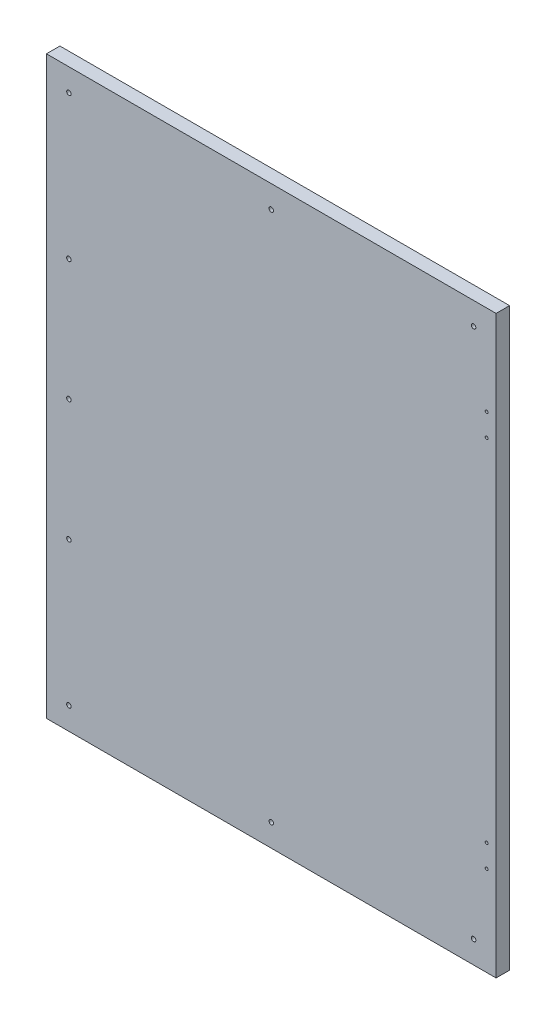
from build123d import *

# Parameters (mm, degrees)
SKETCH_1_W               = 500
SKETCH_1_H               = 640
EXTRUDE_1_DEPTH          = 15
CUT_EXTRUDE_1_DEPTH      = 407.355755466
CUT_EXTRUDE_1_DEPTH_BACK = 407.355755466
SKETCH_2_R               = 2.5
SKETCH_2_3_R             = 2.5
CUT_EXTRUDE_2_DEPTH      = 407.355755466
SKETCH_3_R               = 1.6
CUT_EXTRUDE_3_DEPTH      = 407.355755466


with BuildPart() as part:
    # ｽｹｯﾁ1 → ﾎﾞｽ - 押し出し1 (new body)
    with BuildSketch(Plane.XY):
        Rectangle(SKETCH_1_W, SKETCH_1_H)
    extrude(amount=EXTRUDE_1_DEPTH)

    # ｽｹｯﾁ2 → ｶｯﾄ - 押し出し1 (cut, two sides: drawn at the far end of the back side and taken through both)
    with BuildSketch(Plane.XY.offset(15).offset(-CUT_EXTRUDE_1_DEPTH_BACK)):
        with Locations((-225, 135)):
            Circle(SKETCH_2_R)
        with Locations((-225, 0)):
            Circle(SKETCH_2_R)
        with Locations((-225, -135)):
            Circle(SKETCH_2_R)
    extrude(amount=CUT_EXTRUDE_1_DEPTH + CUT_EXTRUDE_1_DEPTH_BACK, mode=Mode.SUBTRACT)

    # ｽｹｯﾁ2<3> → ｶｯﾄ - 押し出し2 (cut, through all)
    with BuildSketch(Plane.XY.offset(15)):
        with Locations((0, 295)):
            Circle(SKETCH_2_3_R)
        with Locations((-225, 295)):
            Circle(SKETCH_2_3_R)
        with Locations((225, 295)):
            Circle(SKETCH_2_3_R)
    cut_extrude_2 = extrude(amount=-CUT_EXTRUDE_2_DEPTH, mode=Mode.SUBTRACT)

    # ﾐﾗｰ1: ｶｯﾄ - 押し出し2 across plane
    add(cut_extrude_2.mirror(Plane.ZX), mode=Mode.SUBTRACT)

    # ｽｹｯﾁ3 → ｶｯﾄ - 押し出し3 (cut, through all)
    with BuildSketch(Plane.XY.offset(15)):
        with Locations((239.5, -220)):
            Circle(SKETCH_3_R)
        with Locations((239.5, -195)):
            Circle(SKETCH_3_R)
    cut_extrude_3 = extrude(amount=-CUT_EXTRUDE_3_DEPTH, mode=Mode.SUBTRACT)

    # ﾐﾗｰ2: ｶｯﾄ - 押し出し3 across plane
    add(cut_extrude_3.mirror(Plane.ZX), mode=Mode.SUBTRACT)


solid = part.part
